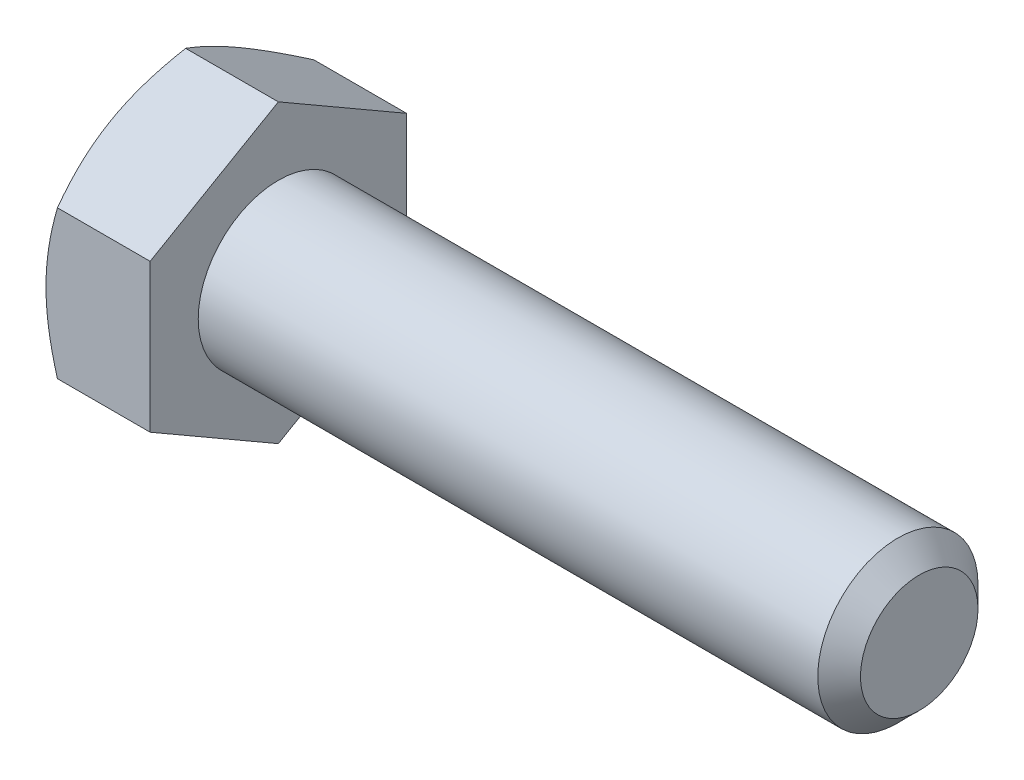
from build123d import *

# Parameters (mm, degrees)
SKETCH5_R           = 3.96875
BOSS_EXTRUDE3_DEPTH = 31.75
CHAMFER1_SIZE       = 1.058333333
BOSS_EXTRUDE4_DEPTH = 5.159375
SKETCH8_OUTSIDE_W   = 158.702
SKETCH8_OUTSIDE_H   = 160.666
SKETCH8_OUTSIDE_R   = 6.35
CUT_EXTRUDE3_DEPTH  = 39.16264923
CUT_EXTRUDE3_DRAFT  = -60
CUT_EXTRUDE4_DEPTH  = 0.254
CIRPATTERN1_COUNT   = 6


with BuildPart() as part:
    # Sketch5 → Boss-Extrude3 (new body)
    with BuildSketch(Plane(origin=(18.4546875, 0, 0), x_dir=(0, 0, -1), z_dir=(1, 0, 0))):
        Circle(SKETCH5_R)
    extrude(amount=-BOSS_EXTRUDE3_DEPTH)

    # Chamfer1
    chamfer1_edges = [part.edges().sort_by_distance(p)[0] for p in [
        (18.4546875, 0, 3.96875),
    ]]
    chamfer(chamfer1_edges, length=CHAMFER1_SIZE)

    # Sketch6 → Boss-Extrude4 (add)
    with BuildSketch(Plane.ZY.offset(13.2953125)):
        Polygon((6.35, 3.666174209), (0, 7.332348419), (-6.35, 3.666174209), (-6.35, -3.666174209), (0, -7.332348419), (6.35, -3.666174209), align=None)
    extrude(amount=BOSS_EXTRUDE4_DEPTH)


with BuildPart() as cut_extrude3_tool:
    # Sketch8 outside → Cut-Extrude3 (with draft: the straight prism first)
    with BuildSketch(Plane.ZY.offset(18.4546875)):
        Rectangle(SKETCH8_OUTSIDE_W, SKETCH8_OUTSIDE_H)
        Circle(SKETCH8_OUTSIDE_R, mode=Mode.SUBTRACT)
    extrude(amount=-CUT_EXTRUDE3_DEPTH)
    # Cut-Extrude3: the draft: its side faces are tilted about the plane it starts from
    cut_extrude3_sides = [cut_extrude3_tool.faces().sort_by_distance(p)[0] for p in [
        (1.126637115, -80.333, 0),
        (1.126637115, 0, 79.351),
        (1.126637115, 80.333, 0),
        (1.126637115, 0, -79.351),
        (1.126637115, 0, -6.35),
    ]]
    draft(cut_extrude3_sides, Plane.ZY.offset(18.4546875), CUT_EXTRUDE3_DRAFT)


with BuildPart() as part_1:
    add(part.part)

    # Cut-Extrude3: cut by cut_extrude3_tool
    add(cut_extrude3_tool.part, mode=Mode.SUBTRACT)

    # Sketch12 → Cut-Extrude4 (cut)
    with BuildSketch(Plane.ZY.offset(18.4546875)):
        with BuildLine():
            Line((0.1905, 4.8895), (0.1905, 2.7305))
            ThreePointArc((0.1905, 2.7305), (0, 2.54), (-0.1905, 2.7305))
            Line((-0.1905, 2.7305), (-0.1905, 4.8895))
            ThreePointArc((-0.1905, 4.8895), (0, 5.08), (0.1905, 4.8895))
        make_face()
    cut_extrude4 = extrude(amount=-CUT_EXTRUDE4_DEPTH, mode=Mode.SUBTRACT)

    # CirPattern1: Cut-Extrude4 ×6 about axis
    cirpattern1_axis = Axis((0, 0, 0), (1, 0, 0))
    for i in range(1, CIRPATTERN1_COUNT):
        add(cut_extrude4.rotate(cirpattern1_axis, i * 360 / CIRPATTERN1_COUNT), mode=Mode.SUBTRACT)


solid = part_1.part
